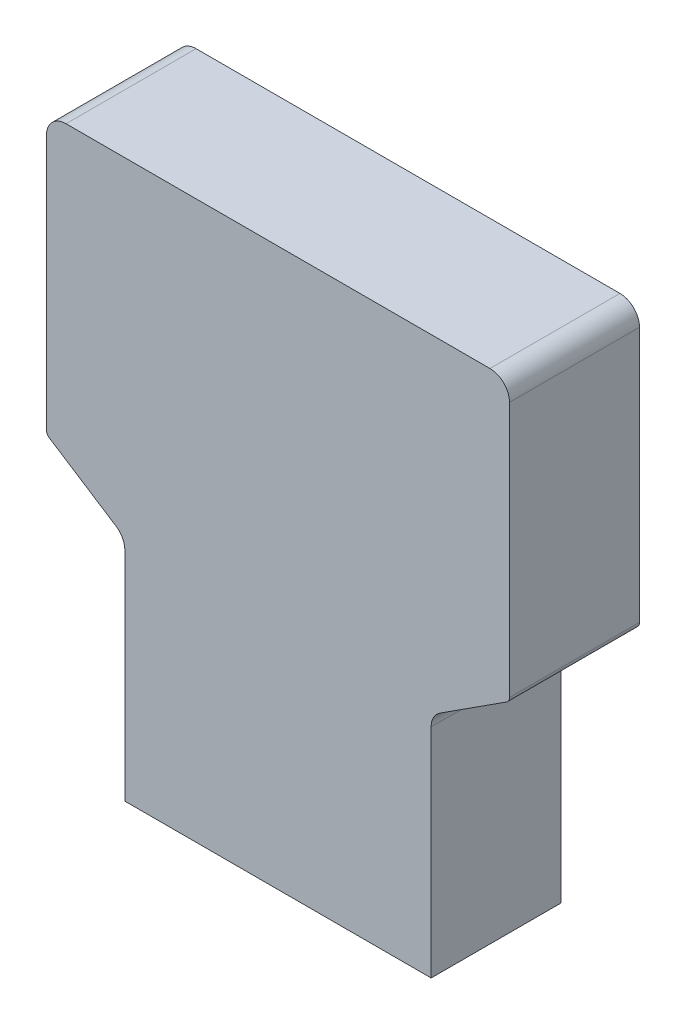
from build123d import *

# Parameters (mm, degrees)
BOSS_EXTRUDE1_DEPTH = 9.975


with BuildPart() as part:
    # Sketch1 → Boss-Extrude1 (new, symmetric)
    with BuildSketch(Plane.XY):
        with BuildLine():
            Line((20.217281255, -38.799092726), (20.217281255, -5.434329714))
            ThreePointArc((20.217281255, -5.434329714), (20.583178789, -3.998535787), (21.591617389, -2.912977499))
            Line((21.591617389, -2.912977499), (31.77916921, 3.655535531))
            ThreePointArc((31.77916921, 3.655535531), (32.11531541, 4.017388294), (32.237281255, 4.495986269))
            Line((32.237281255, 4.495986269), (32.237281255, 43.700907274))
            ThreePointArc((32.237281255, 43.700907274), (31.358601598, 45.822227617), (29.237281255, 46.700907274))
            Line((29.237281255, 46.700907274), (-35.802718745, 46.700907274))
            ThreePointArc((-35.802718745, 46.700907274), (-37.924039089, 45.822227617), (-38.802718745, 43.700907274))
            Line((-38.802718745, 43.700907274), (-38.802718745, 4.495986269))
            ThreePointArc((-38.802718745, 4.495986269), (-38.6807529, 4.017388294), (-38.344606701, 3.655535531))
            Line((-38.344606701, 3.655535531), (-28.157054879, -2.912977499))
            ThreePointArc((-28.157054879, -2.912977499), (-27.14861628, -3.998535787), (-26.782718745, -5.434329714))
            Line((-26.782718745, -5.434329714), (-26.782718745, -38.799092726))
            Line((-26.782718745, -38.799092726), (20.217281255, -38.799092726))
        make_face()
    extrude(amount=BOSS_EXTRUDE1_DEPTH, both=True)


solid = part.part
